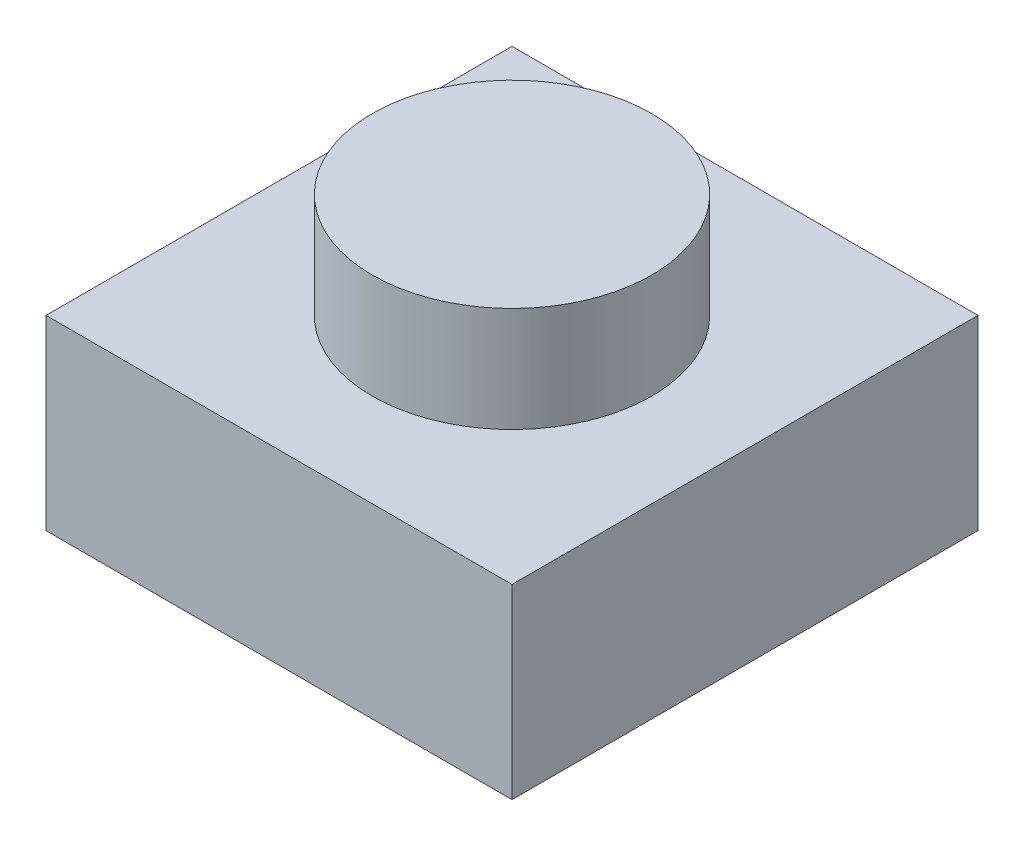
from build123d import *

# Parameters (mm, degrees)
SKETCH1_W           = 8
SKETCH1_H           = 8
BOSS_EXTRUDE1_DEPTH = 3.2
SKETCH2_R           = 2.4
BOSS_EXTRUDE2_DEPTH = 1.8
SKETCH3_W           = 4.8
SKETCH3_H           = 4.8
CUT_EXTRUDE1_DEPTH  = 1.8


with BuildPart() as part:
    # Sketch1 → Boss-Extrude1 (new body)
    with BuildSketch(Plane(origin=(0, 0, 0), x_dir=(1, 0, 0), z_dir=(0, 1, 0))):
        with Locations((4, 4)):
            Rectangle(SKETCH1_W, SKETCH1_H)
    extrude(amount=BOSS_EXTRUDE1_DEPTH)

    # Sketch2 → Boss-Extrude2 (add)
    with BuildSketch(Plane(origin=(0, 3.2, 0), x_dir=(1, 0, 0), z_dir=(0, 1, 0))):
        with Locations((4, 4)):
            Circle(SKETCH2_R)
    extrude(amount=BOSS_EXTRUDE2_DEPTH)

    # Sketch3 → Cut-Extrude1 (cut)
    with BuildSketch(Plane.XZ):
        with Locations((4, -4)):
            Rectangle(SKETCH3_W, SKETCH3_H)
    extrude(amount=-CUT_EXTRUDE1_DEPTH, mode=Mode.SUBTRACT)


solid = part.part
